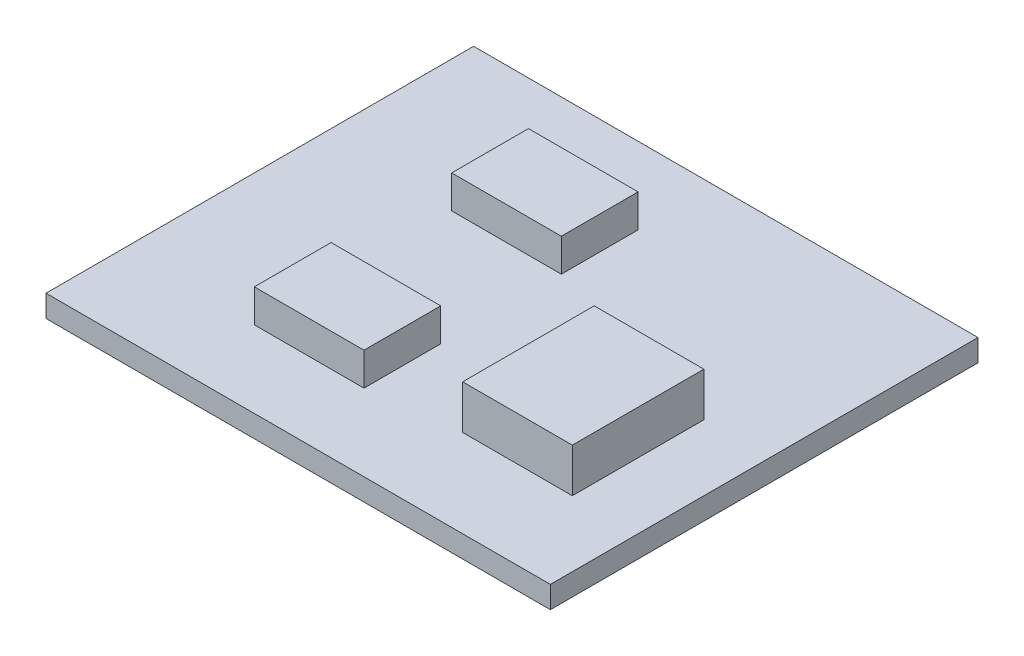
from build123d import *

# Parameters (mm, degrees)
SKIZZE1_W                       = 23
SKIZZE1_H                       = 19.5
AUFSATZ_LINEAR_AUSTRAGEN1_DEPTH = 1
SKIZZE2_W                       = 5
SKIZZE2_H                       = 6
AUFSATZ_LINEAR_AUSTRAGEN2_DEPTH = 2
SKIZZE3_W                       = 5
SKIZZE3_H                       = 3.5
AUFSATZ_LINEAR_AUSTRAGEN3_DEPTH = 1.5
SKIZZE4_W                       = 2.5
SKIZZE4_H                       = 1.5
AUFSATZ_LINEAR_AUSTRAGEN4_DEPTH = 2


with BuildPart() as part:
    # Skizze1 → Aufsatz-Linear austragen1 (new body)
    with BuildSketch(Plane(origin=(0, 0, 0), x_dir=(1, 0, 0), z_dir=(0, 1, 0))):
        with Locations((11.5, 9.75)):
            Rectangle(SKIZZE1_W, SKIZZE1_H)
    extrude(amount=AUFSATZ_LINEAR_AUSTRAGEN1_DEPTH)

    # Skizze2 → Aufsatz-Linear austragen2 (add)
    with BuildSketch(Plane(origin=(0, 1, 0), x_dir=(1, 0, 0), z_dir=(0, 1, 0))):
        with Locations((17.5, 7)):
            Rectangle(SKIZZE2_W, SKIZZE2_H)
    extrude(amount=AUFSATZ_LINEAR_AUSTRAGEN2_DEPTH)

    # Skizze3 → Aufsatz-Linear austragen3 (add)
    with BuildSketch(Plane(origin=(0, 1, 0), x_dir=(1, 0, 0), z_dir=(0, 1, 0))):
        with Locations((8.5, 14.25)):
            Rectangle(SKIZZE3_W, SKIZZE3_H)
        with Locations((8.5, 5.25)):
            Rectangle(SKIZZE3_W, SKIZZE3_H)
    aufsatz_linear_austragen3 = extrude(amount=AUFSATZ_LINEAR_AUSTRAGEN3_DEPTH)

    # Spiegeln1: Aufsatz-Linear austragen3 across plane
    add(aufsatz_linear_austragen3.mirror(Plane.ZX.offset(0.5)))

    # Skizze4 → Aufsatz-Linear austragen4 (add)
    with BuildSketch(Plane.XZ):
        with Locations((17.25, -8.25)):
            Rectangle(SKIZZE4_W, SKIZZE4_H)
        with Locations((17.25, -5.25)):
            Rectangle(SKIZZE4_W, SKIZZE4_H)
    extrude(amount=AUFSATZ_LINEAR_AUSTRAGEN4_DEPTH)


solid = part.part
